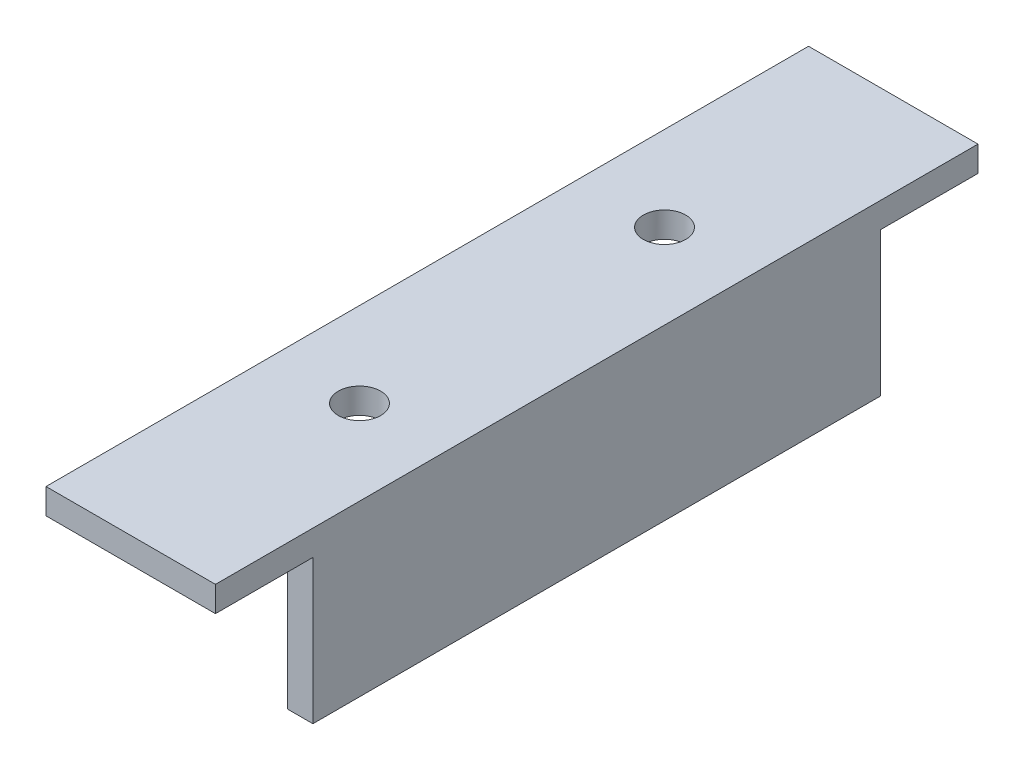
from build123d import *

# Parameters (mm, degrees)
BOSS_EXTRUDE1_DEPTH = 180
SKETCH2_W           = 23
SKETCH2_H           = 34
CUT_EXTRUDE1_DEPTH  = 200
SKETCH3_R           = 5
CUT_EXTRUDE2_DEPTH  = 200


with BuildPart() as part:
    # Sketch1 → Boss-Extrude1 (new body)
    with BuildSketch(Plane.XY):
        Polygon((0, 0), (40, 0), (40, -40), (34, -40), (34, -6), (0, -6), align=None)
    extrude(amount=-BOSS_EXTRUDE1_DEPTH)

    # Sketch2 → Cut-Extrude1 (cut)
    with BuildSketch(Plane.ZY.offset(-34)):
        with Locations((-11.5, -23)):
            Rectangle(SKETCH2_W, SKETCH2_H)
        with Locations((-168.5, -23)):
            Rectangle(SKETCH2_W, SKETCH2_H)
    extrude(amount=-CUT_EXTRUDE1_DEPTH, mode=Mode.SUBTRACT)

    # Sketch3 → Cut-Extrude2 (cut)
    with BuildSketch(Plane(origin=(0, 0, 0), x_dir=(1, 0, 0), z_dir=(0, 1, 0))):
        with Locations(Location((20, 126, 0), (0, 0, 270))):
            Circle(SKETCH3_R)
        with Locations(Location((20, 54, 0), (0, 0, 90))):
            Circle(SKETCH3_R)
    extrude(amount=-CUT_EXTRUDE2_DEPTH, mode=Mode.SUBTRACT)


solid = part.part
